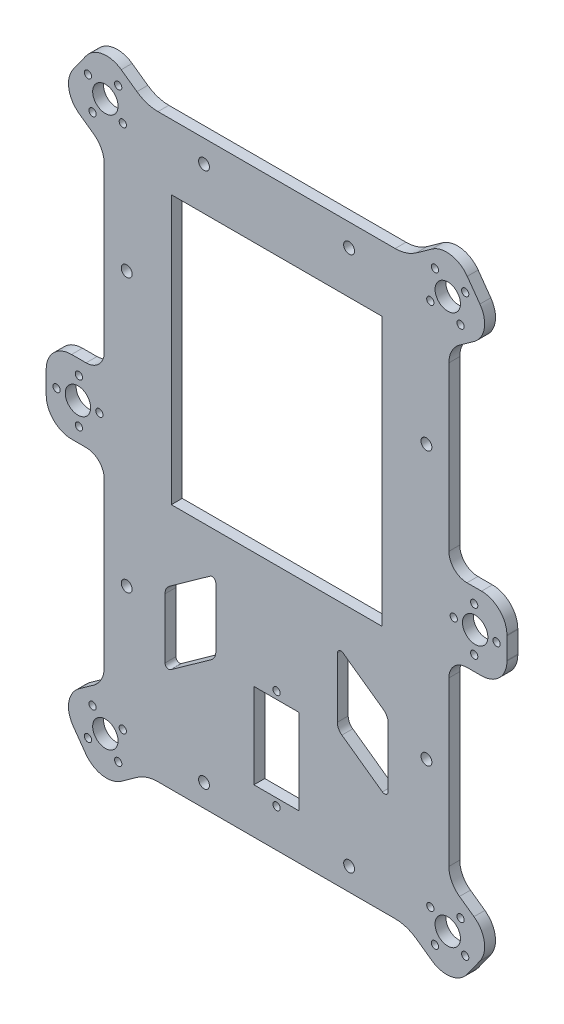
from build123d import *

# Parameters (mm, degrees)
SKETCH1_R       = 1
SKETCH1_R_2     = 3.5
SKETCH1_R_3     = 1.5
SKETCH1_W       = 58.004829366
SKETCH1_H       = 74
SKETCH1_W_2     = 12.5
SKETCH1_H_2     = 23.5
EXTRUDE_1_DEPTH = 3


with BuildPart() as part:
    # Sketch1 → Бобышка-Вытянуть1 (new body)
    with BuildSketch(Plane.XY):
        with BuildLine():
            Line((-24.498196466, 18.686253871), (-28.812938034, 21.763271713))
            ThreePointArc((-28.812938034, 21.763271713), (-34.033313652, 22.967935089), (-38.576502294, 20.128397731))
            Line((-38.576502294, 20.128397731), (-42.0602267, 15.24335277))
            ThreePointArc((-42.0602267, 15.24335277), (-43.264890076, 10.022977152), (-40.425352718, 5.47978851))
            Line((-40.425352718, 5.47978851), (-36.440527218, 2.638047245))
            ThreePointArc((-36.440527218, 2.638047245), (-34.281914219, 0.144259766), (-33.504872357, -3.061171876))
            Line((-33.504872357, -3.061171876), (-33.504872357, -48.061171876))
            ThreePointArc((-33.504872357, -48.061171876), (-34.969338451, -51.596705782), (-38.504872357, -53.061171876))
            Line((-38.504872357, -53.061171876), (-42.504872357, -53.061171876))
            ThreePointArc((-42.504872357, -53.061171876), (-47.454619825, -55.111424408), (-49.504872357, -60.061171876))
            Line((-49.504872357, -60.061171876), (-49.500334917, -60.235639257))
            Line((-49.500334917, -60.235639257), (-49.500334917, -66.108369799))
            Line((-49.500334917, -66.108369799), (-49.504872357, -66.28283718))
            ThreePointArc((-49.504872357, -66.28283718), (-47.454619825, -71.232584649), (-42.504872357, -73.28283718))
            Line((-42.504872357, -73.28283718), (-38.504872357, -73.28283718))
            ThreePointArc((-38.504872357, -73.28283718), (-34.969338451, -74.747303275), (-33.504872357, -78.28283718))
            Line((-33.504872357, -78.28283718), (-33.504872357, -123.28283718))
            ThreePointArc((-33.504872357, -123.28283718), (-34.281914219, -126.488268823), (-36.440527218, -128.982056301))
            Line((-36.440527218, -128.982056301), (-40.425352718, -131.823797566))
            ThreePointArc((-40.425352718, -131.823797566), (-43.264890076, -136.366986209), (-42.0602267, -141.587361827))
            Line((-42.0602267, -141.587361827), (-38.576502294, -146.472406787))
            ThreePointArc((-38.576502294, -146.472406787), (-34.033313652, -149.311944145), (-28.812938034, -148.107280769))
            Line((-28.812938034, -148.107280769), (-24.498196466, -145.030262927))
            ThreePointArc((-24.498196466, -145.030262927), (-21.740151192, -143.647892601), (-18.691989124, -143.172004528))
            Line((-18.691989124, -143.172004528), (46.687073776, -143.172004528))
            ThreePointArc((46.687073776, -143.172004528), (49.735235844, -143.647892601), (52.493281118, -145.030262927))
            Line((52.493281118, -145.030262927), (56.808022686, -148.107280769))
            ThreePointArc((56.808022686, -148.107280769), (62.028398304, -149.311944145), (66.571586947, -146.472406787))
            Line((66.571586947, -146.472406787), (70.055311352, -141.587361827))
            ThreePointArc((70.055311352, -141.587361827), (71.259974728, -136.366986209), (68.42043737, -131.823797566))
            Line((68.42043737, -131.823797566), (64.43561187, -128.982056301))
            ThreePointArc((64.43561187, -128.982056301), (62.276998871, -126.488268823), (61.499957009, -123.28283718))
            Line((61.499957009, -123.28283718), (61.499957009, -78.28283718))
            ThreePointArc((61.499957009, -78.28283718), (62.964423103, -74.747303275), (66.499957009, -73.28283718))
            Line((66.499957009, -73.28283718), (70.499957009, -73.28283718))
            ThreePointArc((70.499957009, -73.28283718), (75.449704478, -71.232584649), (77.499957009, -66.28283718))
            Line((77.499957009, -66.28283718), (77.495419569, -66.108369799))
            Line((77.495419569, -66.108369799), (77.495419569, -60.235639257))
            Line((77.495419569, -60.235639257), (77.499957009, -60.061171876))
            ThreePointArc((77.499957009, -60.061171876), (75.449704478, -55.111424407), (70.499957009, -53.061171876))
            Line((70.499957009, -53.061171876), (66.499957009, -53.061171876))
            ThreePointArc((66.499957009, -53.061171876), (62.964423103, -51.596705782), (61.499957009, -48.061171876))
            Line((61.499957009, -48.061171876), (61.499957009, -3.061171876))
            ThreePointArc((61.499957009, -3.061171876), (62.276998871, 0.144259766), (64.43561187, 2.638047245))
            Line((64.43561187, 2.638047245), (68.42043737, 5.47978851))
            ThreePointArc((68.42043737, 5.47978851), (71.259974728, 10.022977152), (70.055311352, 15.24335277))
            Line((70.055311352, 15.24335277), (66.571586947, 20.128397731))
            ThreePointArc((66.571586947, 20.128397731), (62.028398304, 22.967935089), (56.808022686, 21.763271713))
            Line((56.808022686, 21.763271713), (52.493281118, 18.686253871))
            ThreePointArc((52.493281118, 18.686253871), (49.735235844, 17.303883544), (46.687073776, 16.827995472))
            Line((46.687073776, 16.827995472), (-18.691989124, 16.827995472))
            ThreePointArc((-18.691989124, 16.827995472), (-21.740151192, 17.303883544), (-24.498196466, 18.686253871))
        make_face()
        with Locations((-37.997968141, 16.031106158)):
            Circle(SKETCH1_R, mode=Mode.SUBTRACT)
        with Locations((-29.658360325, 17.563764462)):
            Circle(SKETCH1_R, mode=Mode.SUBTRACT)
        with Locations((-36.730320867, 7.647123191)):
            Circle(SKETCH1_R, mode=Mode.SUBTRACT)
        with Locations(Location((-28.390713051, 9.179781495, 0), (0, 0, 180))):
            Circle(SKETCH1_R, mode=Mode.SUBTRACT)
        with Locations((-33.194340596, 12.605443826)):
            Circle(SKETCH1_R_2, mode=Mode.SUBTRACT)
        with Locations(Location((61.189425248, 12.605443826, 0), (0, 0, 180))):
            Circle(SKETCH1_R_2, mode=Mode.SUBTRACT)
        with Locations(Location((56.385797703, 9.179781495, 0), (0, 0, 180))):
            Circle(SKETCH1_R, mode=Mode.SUBTRACT)
        with Locations(Location((64.725405519, 7.647123191, 0), (0, 0, 180))):
            Circle(SKETCH1_R, mode=Mode.SUBTRACT)
        with Locations(Location((57.653444977, 17.563764462, 0), (0, 0, 180))):
            Circle(SKETCH1_R, mode=Mode.SUBTRACT)
        with Locations((65.993052793, 16.031106158)):
            Circle(SKETCH1_R, mode=Mode.SUBTRACT)
        with Locations((65.993052793, -142.375115215)):
            Circle(SKETCH1_R, mode=Mode.SUBTRACT)
        with Locations((57.653444977, -143.907773518)):
            Circle(SKETCH1_R, mode=Mode.SUBTRACT)
        with Locations((64.725405519, -133.991132248)):
            Circle(SKETCH1_R, mode=Mode.SUBTRACT)
        with Locations(Location((56.385797703, -135.523790551, 0), (0, 0, 180))):
            Circle(SKETCH1_R, mode=Mode.SUBTRACT)
        with Locations((61.189425248, -138.949452883)):
            Circle(SKETCH1_R_2, mode=Mode.SUBTRACT)
        with Locations(Location((-33.194340596, -138.949452883, 0), (0, 0, 180))):
            Circle(SKETCH1_R_2, mode=Mode.SUBTRACT)
        with Locations(Location((-28.390713051, -135.523790551, 0), (0, 0, 180))):
            Circle(SKETCH1_R, mode=Mode.SUBTRACT)
        with Locations(Location((-36.730320867, -133.991132248, 0), (0, 0, 180))):
            Circle(SKETCH1_R, mode=Mode.SUBTRACT)
        with Locations(Location((-29.658360325, -143.907773518, 0), (0, 0, 180))):
            Circle(SKETCH1_R, mode=Mode.SUBTRACT)
        with Locations((-37.997968141, -142.375115215)):
            Circle(SKETCH1_R, mode=Mode.SUBTRACT)
        with Locations((55.309957009, -25.561171876)):
            Circle(SKETCH1_R_3, mode=Mode.SUBTRACT)
        with Locations((33.997542326, -136.982004528)):
            Circle(SKETCH1_R_3, mode=Mode.SUBTRACT)
        with Locations((-6.002457674, -136.982004528)):
            Circle(SKETCH1_R_3, mode=Mode.SUBTRACT)
        with Locations(Location((-6.002457674, 10.637995472, 0), (0, 0, 180))):
            Circle(SKETCH1_R_3, mode=Mode.SUBTRACT)
        with Locations(Location((33.997542326, 10.637995472, 0), (0, 0, 180))):
            Circle(SKETCH1_R_3, mode=Mode.SUBTRACT)
        with Locations((13.997542326, -132.673899794)):
            Circle(SKETCH1_R, mode=Mode.SUBTRACT)
        with Locations(Location((13.997542326, -105.173899794, 0), (0, 0, 180))):
            Circle(SKETCH1_R, mode=Mode.SUBTRACT)
        with Locations((-27.314872357, -25.561171876)):
            Circle(SKETCH1_R_3, mode=Mode.SUBTRACT)
        with Locations((55.309957009, -100.78283718)):
            Circle(SKETCH1_R_3, mode=Mode.SUBTRACT)
        with Locations((-27.314872357, -100.78283718)):
            Circle(SKETCH1_R_3, mode=Mode.SUBTRACT)
        with Locations((-40.750334917, -63.172004528)):
            Circle(SKETCH1_R_2, mode=Mode.SUBTRACT)
        with Locations((-46.650334917, -63.172004528)):
            Circle(SKETCH1_R, mode=Mode.SUBTRACT)
        with Locations(Location((-34.850334917, -63.172004528, 0), (0, 0, 180))):
            Circle(SKETCH1_R, mode=Mode.SUBTRACT)
        with Locations((-40.487335358, -69.256322997)):
            Circle(SKETCH1_R, mode=Mode.SUBTRACT)
        with Locations(Location((-40.487335358, -57.087686059, 0), (0, 0, 180))):
            Circle(SKETCH1_R, mode=Mode.SUBTRACT)
        with Locations((68.48242001, -57.087686059)):
            Circle(SKETCH1_R, mode=Mode.SUBTRACT)
        with Locations(Location((68.48242001, -69.256322997, 0), (0, 0, 180))):
            Circle(SKETCH1_R, mode=Mode.SUBTRACT)
        with Locations((62.845419569, -63.172004528)):
            Circle(SKETCH1_R, mode=Mode.SUBTRACT)
        with Locations(Location((74.645419569, -63.172004528, 0), (0, 0, 180))):
            Circle(SKETCH1_R, mode=Mode.SUBTRACT)
        with Locations(Location((68.745419569, -63.172004528, 0), (0, 0, 180))):
            Circle(SKETCH1_R_2, mode=Mode.SUBTRACT)
        with Locations((13.997542326, -38.172004528)):
            Rectangle(SKETCH1_W, SKETCH1_H, mode=Mode.SUBTRACT)
        with Locations((13.997542326, -118.923899794)):
            Rectangle(SKETCH1_W_2, SKETCH1_H_2, mode=Mode.SUBTRACT)
        with BuildLine():
            Line((32.005035086, -106.680183908), (43.167511474, -114.653381328))
            ThreePointArc((43.167511474, -114.653381328), (44.206331249, -114.728815499), (44.748749668, -113.839647857))
            Line((44.748749668, -113.839647857), (44.748749668, -100.78283718))
            Line((44.748749668, -100.78283718), (44.748749668, -97.326690866))
            ThreePointArc((44.748749668, -97.326690866), (44.416252596, -95.953946124), (43.492464249, -94.885490453))
            Line((43.492464249, -94.885490453), (32.329987861, -86.912293033))
            ThreePointArc((32.329987861, -86.912293033), (31.291168087, -86.836858862), (30.748749668, -87.726026504))
            Line((30.748749668, -87.726026504), (30.748749668, -100.78283718))
            Line((30.748749668, -100.78283718), (30.748749668, -104.238983495))
            ThreePointArc((30.748749668, -104.238983495), (31.081246739, -105.611728237), (32.005035086, -106.680183908))
        make_face(mode=Mode.SUBTRACT)
        with BuildLine():
            Line((-2.753665015, -100.78283718), (-2.753665015, -87.726026504))
            ThreePointArc((-2.753665015, -87.726026504), (-3.296083435, -86.836858862), (-4.334903209, -86.912293033))
            Line((-4.334903209, -86.912293033), (-15.497379597, -94.885490453))
            ThreePointArc((-15.497379597, -94.885490453), (-16.421167944, -95.953946124), (-16.753665015, -97.326690866))
            Line((-16.753665015, -97.326690866), (-16.753665015, -100.78283718))
            Line((-16.753665015, -100.78283718), (-16.753665015, -113.839647857))
            ThreePointArc((-16.753665015, -113.839647857), (-16.211246596, -114.728815499), (-15.172426822, -114.653381328))
            Line((-15.172426822, -114.653381328), (-4.009950434, -106.680183908))
            ThreePointArc((-4.009950434, -106.680183908), (-3.086162087, -105.611728237), (-2.753665015, -104.238983495))
            Line((-2.753665015, -104.238983495), (-2.753665015, -100.78283718))
        make_face(mode=Mode.SUBTRACT)
    extrude(amount=-EXTRUDE_1_DEPTH)


solid = part.part
